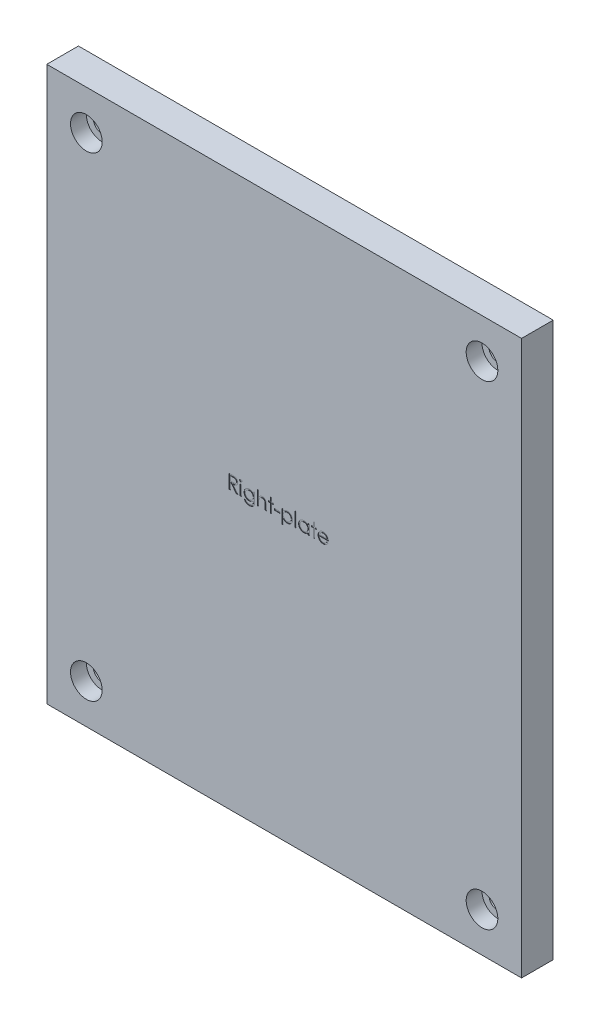
from build123d import *

# Parameters (mm, degrees)
SKETCH_1_W                   = 120
SKETCH_1_H                   = 140
EXTRUDE_1_DEPTH              = 8
HOLE_WIZARD_M4_1_D           = 4.5
HOLE_WIZARD_M4_1_CBORE_D     = 8
HOLE_WIZARD_M4_1_CBORE_DEPTH = 4
SKETCH_4_W                   = 0.314102564
SKETCH_4_H                   = 2.557692308
SKETCH_4_W_2                 = 1.346153846
SKETCH_4_H_2                 = 0.358974359
SKETCH_4_H_3                 = 3.58974359
CUT_EXTRUDE_1_DEPTH          = 0.1


with BuildPart() as part:
    # 스케치1 → 보스-돌출1 (new body)
    with BuildSketch(Plane.XY):
        Rectangle(SKETCH_1_W, SKETCH_1_H)
    extrude(amount=EXTRUDE_1_DEPTH)

    # M4 소켓 머리 캡 나사용 카운터보어1 (through all)
    with Locations(Plane.XY.offset(8)):
        with Locations((-50, 60), (50, 60), (50, -60), (-50, -60)):
            CounterBoreHole(HOLE_WIZARD_M4_1_D / 2, HOLE_WIZARD_M4_1_CBORE_D / 2, HOLE_WIZARD_M4_1_CBORE_DEPTH)

    # 스케치4 → 컷-돌출1 (cut)
    # profile 1 of 12: a face of its own
    with BuildSketch(Plane.XY.offset(8)):
        with BuildLine():
            Line((-13.94105968, 3.5), (-13.240639007, 3.5))
            add(Edge.make_bspline(
                [(-13.240639007, 3.5), (-13.193897878, 3.499844414), (-13.104149734, 3.499545672), (-12.975576464, 3.497879909), (-12.858749367, 3.493105553), (-12.753729527, 3.48899697), (-12.660518872, 3.481505028), (-12.578831581, 3.474344381), (-12.509043884, 3.46497072), (-12.466798033, 3.456265297), (-12.447670257, 3.452323718)],
                knots=[0, 0, 0, 0, 1.410062039, 2.707475311, 3.878576406, 4.937260626, 5.877586885, 6.699081471, 7.410979367, 8, 8, 8, 8], degree=3))
            add(Edge.make_bspline(
                [(-12.447670257, 3.452323718), (-12.422063633, 3.445996953), (-12.371396643, 3.433478389), (-12.298446577, 3.407018788), (-12.228932253, 3.376399163), (-12.163142429, 3.340435443), (-12.101406638, 3.298860663), (-12.043088327, 3.252392541), (-11.987922864, 3.201285335), (-11.938141233, 3.144250494), (-11.891202182, 3.084413984), (-11.851613555, 3.019710227), (-11.817487075, 2.9520487), (-11.790316558, 2.880741282), (-11.768438585, 2.80647951), (-11.753012346, 2.728590713), (-11.743761158, 2.647429738), (-11.742819302, 2.59207183), (-11.742341731, 2.564002404)],
                knots=[0, 0, 0, 0, 1.027469482, 2.033020251, 3.019912614, 3.986113645, 4.951240523, 5.91722682, 6.890402269, 7.87763091, 8.8651537, 9.85103654, 10.82876324, 11.815024772, 12.821070561, 13.842952187, 14.906261191, 16, 16, 16, 16], degree=3))
            add(Edge.make_bspline(
                [(-11.742341731, 2.564002404), (-11.743810729, 2.517367299), (-11.746677125, 2.426370131), (-11.773402229, 2.29430925), (-11.817178748, 2.171119935), (-11.877502037, 2.056957297), (-11.954321513, 1.954046652), (-12.046646304, 1.863656197), (-12.154527916, 1.788016284), (-12.254957232, 1.735563479), (-12.343671431, 1.701970571), (-12.416704744, 1.678334212), (-12.496371722, 1.660072247), (-12.581909056, 1.643712115), (-12.673672712, 1.63136042), (-12.771442751, 1.622313826), (-12.875288903, 1.616659777), (-12.946627972, 1.615817772), (-12.983327308, 1.615384615)],
                knots=[0, 0, 0, 0, 1.260483769, 2.459530307, 3.627416485, 4.787058657, 5.939039949, 7.08810263, 8.267026773, 9.491475466, 10.141966685, 10.831826277, 11.566392101, 12.351337768, 13.187381173, 14.07005841, 15.007169909, 16, 16, 16, 16], degree=3))
            Line((-12.983327308, 1.615384615), (-11.697469936, 0))
            Line((-11.697469936, 0), (-12.085891411, 0))
            Line((-12.085891411, 0), (-13.371748782, 1.615384615))
            Line((-13.371748782, 1.615384615), (-13.626957116, 1.615384615))
            Line((-13.626957116, 1.615384615), (-13.626957116, 0))
            Line((-13.626957116, 0), (-13.94105968, 0))
            Line((-13.94105968, 0), (-13.94105968, 3.5))
        make_face()
        with BuildLine():
            Line((-13.626957116, 3.141025641), (-13.626957116, 1.974358974))
            Line((-13.626957116, 1.974358974), (-12.986131795, 1.969451122))
            add(Edge.make_bspline(
                [(-12.986131795, 1.969451122), (-12.956211756, 1.969437885), (-12.898218199, 1.969412229), (-12.814317534, 1.973406005), (-12.736197423, 1.977949323), (-12.664156671, 1.984898669), (-12.598163095, 1.99385474), (-12.538249682, 2.005057725), (-12.48431863, 2.018109787), (-12.421420092, 2.038311413), (-12.35118356, 2.070317431), (-12.2748521, 2.11688293), (-12.209849763, 2.175452049), (-12.1549319, 2.242425505), (-12.110802469, 2.316061754), (-12.079690415, 2.395478123), (-12.059947972, 2.478669721), (-12.057619427, 2.535847829), (-12.056444295, 2.564703526)],
                knots=[0, 0, 0, 0, 1.146690395, 2.22261258, 3.21895312, 4.145990853, 4.996080663, 5.770904154, 6.481378293, 7.121626537, 8.300444488, 9.431385265, 10.535395872, 11.636531494, 12.74115979, 13.810798291, 14.895190096, 16, 16, 16, 16], degree=3))
            add(Edge.make_bspline(
                [(-12.056444295, 2.564703526), (-12.057646416, 2.592850099), (-12.060028582, 2.648626338), (-12.07947735, 2.730282248), (-12.112366732, 2.807349198), (-12.15668897, 2.879513683), (-12.210688124, 2.945019419), (-12.274005937, 3.001066572), (-12.344911132, 3.047316037), (-12.411182331, 3.076870418), (-12.470416543, 3.094990271), (-12.521846203, 3.107741435), (-12.579957681, 3.117985904), (-12.64503314, 3.126193964), (-12.71679477, 3.133248909), (-12.795605421, 3.138000687), (-12.880942202, 3.140814551), (-12.940089133, 3.14095364), (-12.970707116, 3.141025641)],
                knots=[0, 0, 0, 0, 1.101028733, 2.181837193, 3.264309656, 4.369019818, 5.486613113, 6.575447106, 7.666700264, 8.788928104, 9.402425223, 10.0903467, 10.862060571, 11.710948788, 12.657782767, 13.684531032, 14.801375019, 16, 16, 16, 16], degree=3))
            Line((-12.970707116, 3.141025641), (-13.626957116, 3.141025641))
        make_face(mode=Mode.SUBTRACT)
    # profile 2 of 12: a face of its own
    with BuildSketch(Plane.XY.offset(8)):
        with BuildLine():
            add(Edge.make_bspline(
                [(-10.958487564, 3.634615385), (-10.938996249, 3.633711232), (-10.900828509, 3.631940728), (-10.845635241, 3.616779251), (-10.795378229, 3.591079566), (-10.750800496, 3.556599885), (-10.71254861, 3.516050441), (-10.685767899, 3.468789473), (-10.668555503, 3.417730834), (-10.666476948, 3.382115745), (-10.665418654, 3.363982372)],
                knots=[0, 0, 0, 0, 1.055194115, 2.066272739, 3.074728998, 4.095836921, 5.109056067, 6.073838105, 7.019297344, 8, 8, 8, 8], degree=3))
            add(Edge.make_bspline(
                [(-10.665418654, 3.363982372), (-10.666500814, 3.346319719), (-10.668640116, 3.311402744), (-10.685754604, 3.261229272), (-10.712776842, 3.214624988), (-10.750775968, 3.174154278), (-10.795384729, 3.139693658), (-10.845633515, 3.113988919), (-10.900828963, 3.098828782), (-10.938996402, 3.097058093), (-10.958487564, 3.096153846)],
                knots=[0, 0, 0, 0, 0.96129708, 1.900370562, 2.859976407, 3.87933698, 4.906634145, 5.921202961, 6.938410037, 8, 8, 8, 8], degree=3))
            add(Edge.make_bspline(
                [(-10.958487564, 3.096153846), (-10.97775584, 3.097023566), (-11.01525902, 3.098716363), (-11.069625862, 3.114286381), (-11.119454352, 3.139702454), (-11.164119024, 3.173928639), (-11.201349217, 3.214873536), (-11.228447543, 3.26120083), (-11.245522505, 3.311409985), (-11.247667133, 3.346322151), (-11.248751988, 3.363982372)],
                knots=[0, 0, 0, 0, 1.054934014, 2.053291228, 3.073705704, 4.106921865, 5.123545215, 6.088680038, 7.033164197, 8, 8, 8, 8], degree=3))
            add(Edge.make_bspline(
                [(-11.248751988, 3.363982372), (-11.247690901, 3.382113221), (-11.24560686, 3.417723354), (-11.228434744, 3.468818387), (-11.201574936, 3.515799889), (-11.164094372, 3.556825388), (-11.119460912, 3.591070823), (-11.069624167, 3.616481804), (-11.015259468, 3.632053144), (-10.977755992, 3.633745758), (-10.958487564, 3.634615385)],
                knots=[0, 0, 0, 0, 0.98631895, 1.937192651, 2.907499808, 3.917963147, 4.944918757, 5.95915025, 6.951458133, 8, 8, 8, 8], degree=3))
        make_face()
    # profile 3 of 12: a face of its own
    with BuildSketch(Plane.XY.offset(8)):
        with Locations((-10.957085321, 1.278846154)):
            Rectangle(SKETCH_4_W, SKETCH_4_H)
    # profile 4 of 12: a face of its own
    with BuildSketch(Plane.XY.offset(8)):
        with BuildLine():
            Line((-7.793623782, 2.557692308), (-7.479521218, 2.557692308))
            Line((-7.479521218, 2.557692308), (-7.479521218, 0.527944712))
            add(Edge.make_bspline(
                [(-7.479521218, 0.527944712), (-7.479798261, 0.484707117), (-7.48033302, 0.401248144), (-7.484183991, 0.280569865), (-7.492304668, 0.169103779), (-7.50151335, 0.06634152), (-7.514760066, -0.02724059), (-7.530936433, -0.111921794), (-7.549172112, -0.187783357), (-7.56519233, -0.234508198), (-7.572770417, -0.256610577)],
                knots=[0, 0, 0, 0, 1.307562039, 2.523909702, 3.650326591, 4.686913197, 5.643429486, 6.506965704, 7.293745905, 8, 8, 8, 8], degree=3))
            add(Edge.make_bspline(
                [(-7.572770417, -0.256610577), (-7.583959656, -0.285340499), (-7.606003582, -0.341941336), (-7.647289216, -0.422175656), (-7.693523119, -0.497722046), (-7.74632987, -0.568159497), (-7.805470674, -0.63313441), (-7.869552166, -0.694058409), (-7.939822358, -0.749642577), (-8.01624107, -0.798927874), (-8.097046703, -0.843314928), (-8.182192805, -0.881761495), (-8.271199243, -0.915248339), (-8.364902135, -0.940331135), (-8.461832369, -0.962065855), (-8.563129801, -0.976210541), (-8.668202597, -0.985837599), (-8.739647977, -0.986727832), (-8.775895417, -0.987179487)],
                knots=[0, 0, 0, 0, 0.981931301, 1.934503488, 2.87077864, 3.801706999, 4.735015492, 5.667491629, 6.616593066, 7.585388521, 8.561939025, 9.551802639, 10.560317337, 11.588439944, 12.640189604, 13.723962949, 14.845264515, 16, 16, 16, 16], degree=3))
            add(Edge.make_bspline(
                [(-8.775895417, -0.987179487), (-8.828780152, -0.986323001), (-8.932078247, -0.984650054), (-9.08268324, -0.965159139), (-9.225717959, -0.937604766), (-9.359292416, -0.895899339), (-9.482562513, -0.844862349), (-9.594686389, -0.786267396), (-9.694657496, -0.719078087), (-9.784781169, -0.642577486), (-9.866122759, -0.551613805), (-9.942650049, -0.444414961), (-10.016310991, -0.319348071), (-10.059479629, -0.227555358), (-10.082085321, -0.179487179)],
                knots=[0, 0, 0, 0, 1.157897085, 2.2616841, 3.32207898, 4.345638746, 5.321241055, 6.241986252, 7.112515963, 7.955008012, 8.825025602, 9.77857164, 10.836726669, 12, 12, 12, 12], degree=3))
            Line((-10.082085321, -0.179487179), (-9.767982757, -0.179487179))
            add(Edge.make_bspline(
                [(-9.767982757, -0.179487179), (-9.742720547, -0.219593055), (-9.693336039, -0.297995104), (-9.600987558, -0.39950826), (-9.499781232, -0.486261624), (-9.386301549, -0.556172398), (-9.260076333, -0.60888219), (-9.121029647, -0.646457486), (-8.968030025, -0.668953753), (-8.861511811, -0.671665047), (-8.806043654, -0.673076923)],
                knots=[0, 0, 0, 0, 0.997731894, 1.950442991, 2.880492273, 3.800895997, 4.748200782, 5.754801363, 6.83083817, 8, 8, 8, 8], degree=3))
            add(Edge.make_bspline(
                [(-8.806043654, -0.673076923), (-8.751276764, -0.671646774), (-8.645691681, -0.668889591), (-8.493860512, -0.646447446), (-8.355265574, -0.608874013), (-8.230705373, -0.556265626), (-8.121649605, -0.49181522), (-8.027637614, -0.419815145), (-7.951492938, -0.338634142), (-7.900279971, -0.263852336), (-7.868445353, -0.197228207), (-7.848173116, -0.139875611), (-7.831699147, -0.075022733), (-7.81791931, -0.002886997), (-7.806548396, 0.07663466), (-7.799345514, 0.163724064), (-7.794139702, 0.258183286), (-7.793799732, 0.323676424), (-7.793623782, 0.357572115)],
                knots=[0, 0, 0, 0, 1.570740765, 3.028230971, 4.391408896, 5.680370741, 6.894727393, 8.017376726, 9.065722033, 10.075533815, 10.603371122, 11.180248986, 11.817768598, 12.521299649, 13.286540596, 14.121245857, 15.027658897, 16, 16, 16, 16], degree=3))
            Line((-7.793623782, 0.357572115), (-7.793623782, 0.490084135))
            add(Edge.make_bspline(
                [(-7.793623782, 0.490084135), (-7.8255049, 0.452142332), (-7.888706356, 0.376926113), (-7.997853683, 0.278364476), (-8.117070598, 0.193478346), (-8.246154141, 0.123859711), (-8.381942383, 0.068178287), (-8.522964613, 0.029235326), (-8.667956669, 0.004075426), (-8.766208818, 0.00136811), (-8.815859359, 0)],
                knots=[0, 0, 0, 0, 1.012485704, 2.007162095, 2.997754123, 3.998611389, 4.999708251, 5.992315798, 6.98544096, 8, 8, 8, 8], degree=3))
            add(Edge.make_bspline(
                [(-8.815859359, 0), (-8.845095629, 0.000515026), (-8.903222186, 0.001538985), (-8.989576934, 0.010497762), (-9.074657372, 0.023496504), (-9.158265076, 0.042577943), (-9.240520689, 0.06706967), (-9.321288281, 0.097686409), (-9.401221807, 0.132301527), (-9.478868305, 0.17307433), (-9.553454436, 0.218436637), (-9.624417621, 0.267575528), (-9.69138616, 0.320233816), (-9.75372265, 0.376930756), (-9.811345321, 0.437584289), (-9.865029189, 0.501547842), (-9.913886536, 0.569714583), (-9.958919925, 0.640841541), (-9.997977476, 0.715402464), (-10.032261848, 0.79178056), (-10.062071253, 0.869812514), (-10.085836654, 0.949759577), (-10.103987768, 1.031571346), (-10.117497995, 1.115113795), (-10.125160926, 1.200644182), (-10.12635585, 1.258265532), (-10.126957116, 1.287259615)],
                knots=[0, 0, 0, 0, 1.028754217, 2.045334182, 3.052854819, 4.056607503, 5.061168794, 6.071104265, 7.095078842, 8.125279047, 9.155117945, 10.165957491, 11.161587969, 12.151493252, 13.128948131, 14.104219989, 15.088194871, 16.07871515, 17.064853787, 18.047899887, 19.02414258, 20.002704429, 20.980574569, 21.971845993, 22.979467364, 24, 24, 24, 24], degree=3))
            add(Edge.make_bspline(
                [(-10.126957116, 1.287259615), (-10.126437949, 1.316262711), (-10.125401628, 1.37415657), (-10.116450648, 1.460035956), (-10.103682459, 1.544765391), (-10.08347469, 1.627471533), (-10.059152167, 1.709096284), (-10.029028595, 1.789036741), (-9.992809836, 1.86731725), (-9.951800086, 1.943995781), (-9.905715993, 2.018043396), (-9.855183512, 2.088370042), (-9.800141638, 2.154458214), (-9.741349723, 2.216974636), (-9.678089906, 2.275316129), (-9.610394913, 2.329341094), (-9.538932033, 2.37995512), (-9.463479783, 2.426066457), (-9.385202394, 2.466848704), (-9.306088577, 2.504061301), (-9.225090342, 2.53359542), (-9.143717802, 2.559618519), (-9.060537887, 2.578053715), (-8.976570494, 2.592275957), (-8.891528156, 2.600940678), (-8.834575261, 2.602022263), (-8.806043654, 2.602564103)],
                knots=[0, 0, 0, 0, 1.008818848, 2.013730394, 3.001654427, 3.987803273, 4.973046549, 5.963777569, 6.957074694, 7.972068341, 8.987420212, 9.989399531, 10.982630087, 11.977756091, 12.973280677, 13.973972381, 14.989194003, 16.018387222, 17.047741039, 18.059210846, 19.057554164, 20.045176975, 21.029480261, 22.018708529, 23.007435371, 24, 24, 24, 24], degree=3))
            add(Edge.make_bspline(
                [(-8.806043654, 2.602564103), (-8.758992715, 2.601207429), (-8.666081568, 2.598528416), (-8.529350565, 2.577507271), (-8.397408326, 2.543993258), (-8.26951031, 2.495977627), (-8.144614659, 2.430427589), (-8.023133004, 2.344084641), (-7.904713869, 2.236174301), (-7.831636039, 2.153421437), (-7.793623782, 2.110376603)],
                knots=[0, 0, 0, 0, 0.96728863, 1.910097829, 2.838038873, 3.762875196, 4.71315279, 5.730631239, 6.819562287, 8, 8, 8, 8], degree=3))
            Line((-7.793623782, 2.110376603), (-7.793623782, 2.557692308))
        make_face()
        with BuildLine():
            add(Edge.make_bspline(
                [(-8.78080327, 2.288461538), (-8.826733973, 2.286900473), (-8.917667028, 2.283809894), (-9.05095537, 2.257425181), (-9.179632304, 2.216079281), (-9.301237732, 2.156936666), (-9.415144842, 2.084842428), (-9.516219662, 1.99750214), (-9.604624578, 1.897755943), (-9.679407517, 1.786505696), (-9.738938883, 1.666483421), (-9.781082303, 1.539972687), (-9.808332326, 1.409017694), (-9.811339978, 1.319645091), (-9.812854552, 1.274639423)],
                knots=[0, 0, 0, 0, 1.026226791, 2.031711442, 3.026614839, 4.04107745, 5.047145931, 6.032893242, 7.017642609, 8.019221815, 9.021877557, 10.003543541, 10.994637589, 12, 12, 12, 12], degree=3))
            add(Edge.make_bspline(
                [(-9.812854552, 1.274639423), (-9.812128795, 1.240706151), (-9.810701443, 1.173969327), (-9.796977866, 1.076031432), (-9.7747969, 0.982751118), (-9.743359694, 0.894122744), (-9.704406999, 0.809637949), (-9.655414628, 0.729878714), (-9.597763657, 0.654774008), (-9.531905319, 0.584879326), (-9.459328937, 0.521218358), (-9.380609738, 0.465280317), (-9.295854488, 0.419529596), (-9.207147678, 0.379988759), (-9.112336922, 0.351109691), (-9.012787836, 0.329070912), (-8.907796139, 0.316462154), (-8.8362244, 0.314899356), (-8.799733558, 0.314102564)],
                knots=[0, 0, 0, 0, 1.039728707, 2.044842319, 3.024901384, 3.974314358, 4.923051295, 5.871625912, 6.837440708, 7.820715446, 8.810779094, 9.792721783, 10.773906224, 11.758876063, 12.764959493, 13.806266761, 14.881525401, 16, 16, 16, 16], degree=3))
            add(Edge.make_bspline(
                [(-8.799733558, 0.314102564), (-8.7627698, 0.314870173), (-8.690487562, 0.316371224), (-8.584916626, 0.329274723), (-8.484883886, 0.350096699), (-8.390481063, 0.379659725), (-8.301351722, 0.417381475), (-8.218497108, 0.465118093), (-8.14014066, 0.519482525), (-8.06878425, 0.582894539), (-8.004260084, 0.652779534), (-7.948029318, 0.728824429), (-7.900114869, 0.809884948), (-7.860437199, 0.895951954), (-7.830145995, 0.987694307), (-7.80982709, 1.084882663), (-7.795620344, 1.187051401), (-7.79429942, 1.257060018), (-7.793623782, 1.29286859)],
                knots=[0, 0, 0, 0, 1.121943988, 2.193949579, 3.223793937, 4.220241907, 5.192961521, 6.155822191, 7.11847367, 8.083710714, 9.04790392, 10.001595906, 10.949595423, 11.902125208, 12.873731292, 13.87582262, 14.913508608, 16, 16, 16, 16], degree=3))
            add(Edge.make_bspline(
                [(-7.793623782, 1.29286859), (-7.794963351, 1.339486444), (-7.797580396, 1.430561349), (-7.822277554, 1.563268117), (-7.862097764, 1.68803679), (-7.917944516, 1.804472766), (-7.987926525, 1.911342316), (-8.072217374, 2.006666161), (-8.169363404, 2.090567017), (-8.279085505, 2.160465211), (-8.39713295, 2.216930645), (-8.520654146, 2.259292417), (-8.64946571, 2.283286732), (-8.736772119, 2.286726675), (-8.78080327, 2.288461538)],
                knots=[0, 0, 0, 0, 1.070913519, 2.092188694, 3.091357305, 4.074328408, 5.051968682, 6.018948707, 6.99050112, 7.9935919, 9.000589572, 9.992915277, 10.987769056, 12, 12, 12, 12], degree=3))
        make_face(mode=Mode.SUBTRACT)
    # profile 5 of 12: a face of its own
    with BuildSketch(Plane.XY.offset(8)):
        with BuildLine():
            Line((-6.7615725, 3.58974359), (-6.447469936, 3.58974359))
            Line((-6.447469936, 3.58974359), (-6.447469936, 2.074619391))
            add(Edge.make_bspline(
                [(-6.447469936, 2.074619391), (-6.413752635, 2.116763373), (-6.348103321, 2.198819866), (-6.237607204, 2.305881057), (-6.124136332, 2.398679678), (-6.003771522, 2.472550135), (-5.878721002, 2.530906678), (-5.748457357, 2.572294325), (-5.612956386, 2.597745421), (-5.520931236, 2.600943839), (-5.474312885, 2.602564103)],
                knots=[0, 0, 0, 0, 1.125788106, 2.19196713, 3.20547328, 4.180437432, 5.132270164, 6.079753143, 7.027236121, 8, 8, 8, 8], degree=3))
            add(Edge.make_bspline(
                [(-5.474312885, 2.602564103), (-5.426982492, 2.600818672), (-5.334345497, 2.597402444), (-5.199464034, 2.570389063), (-5.073503159, 2.524231625), (-4.956837316, 2.4610646), (-4.852012619, 2.382391773), (-4.759162855, 2.29156025), (-4.683322056, 2.186286332), (-4.631722939, 2.089030078), (-4.598149531, 2.002491324), (-4.576897705, 1.928254812), (-4.558878507, 1.845532899), (-4.543178771, 1.754368166), (-4.532715189, 1.654322995), (-4.524310571, 1.545848741), (-4.518334117, 1.428951622), (-4.518102513, 1.348031373), (-4.517982757, 1.306189904)],
                knots=[0, 0, 0, 0, 1.235656852, 2.418478516, 3.575258207, 4.727955599, 5.870717718, 6.98870536, 8.107142894, 9.245821548, 9.854588956, 10.528768408, 11.260415777, 12.065282286, 12.943670737, 13.886611085, 14.907229059, 16, 16, 16, 16], degree=3))
            Line((-4.517982757, 1.306189904), (-4.517982757, 0))
            Line((-4.517982757, 0), (-4.832085321, 0))
            Line((-4.832085321, 0), (-4.832085321, 1.203125))
            add(Edge.make_bspline(
                [(-4.832085321, 1.203125), (-4.832275624, 1.23794767), (-4.832639642, 1.30455751), (-4.833842986, 1.399923618), (-4.836529202, 1.486419753), (-4.840870027, 1.563768705), (-4.845435335, 1.632078308), (-4.851718652, 1.691249362), (-4.859028886, 1.741363138), (-4.865597667, 1.771527766), (-4.868543654, 1.78505609)],
                knots=[0, 0, 0, 0, 1.430932559, 2.737130458, 3.918967929, 4.986496826, 5.920444988, 6.731744033, 7.431208747, 8, 8, 8, 8], degree=3))
            add(Edge.make_bspline(
                [(-4.868543654, 1.78505609), (-4.879967899, 1.824750353), (-4.901930944, 1.901062344), (-4.952978921, 2.004724754), (-5.016737932, 2.093109495), (-5.094585194, 2.165023783), (-5.185143558, 2.221435322), (-5.289003522, 2.260503105), (-5.40518759, 2.284750827), (-5.487039062, 2.28719013), (-5.529701507, 2.288461538)],
                knots=[0, 0, 0, 0, 1.090059168, 2.095632401, 3.037101401, 3.955032261, 4.878929692, 5.839099886, 6.873700383, 8, 8, 8, 8], degree=3))
            add(Edge.make_bspline(
                [(-5.529701507, 2.288461538), (-5.55496928, 2.287985712), (-5.60497355, 2.287044064), (-5.679122216, 2.277590166), (-5.75105128, 2.262141447), (-5.821453457, 2.241236908), (-5.888836655, 2.212791372), (-5.95516498, 2.179861183), (-6.018559189, 2.139552928), (-6.080145006, 2.09432716), (-6.137462539, 2.0442574), (-6.190789655, 1.991410445), (-6.238327995, 1.935135481), (-6.281396586, 1.876335365), (-6.318574872, 1.814203572), (-6.351027954, 1.749339253), (-6.37856365, 1.681657108), (-6.392246342, 1.634682046), (-6.399092532, 1.611177885)],
                knots=[0, 0, 0, 0, 1.024319606, 2.027102035, 3.025350316, 4.005802111, 5.00026367, 5.987881639, 7.005602596, 8.042517216, 9.083927026, 10.089214625, 11.084353441, 12.06828073, 13.041928858, 14.016821737, 15.00770877, 16, 16, 16, 16], degree=3))
            add(Edge.make_bspline(
                [(-6.399092532, 1.611177885), (-6.40303196, 1.594156934), (-6.411616456, 1.557066187), (-6.42093129, 1.495891863), (-6.429269086, 1.424805491), (-6.436317636, 1.34391489), (-6.440640723, 1.252923648), (-6.445298963, 1.152452689), (-6.447032977, 1.041872668), (-6.44731993, 0.964977161), (-6.447469936, 0.924779647)],
                knots=[0, 0, 0, 0, 0.607992626, 1.324890765, 2.152360218, 3.099583803, 4.150613268, 5.323148443, 6.60066238, 8, 8, 8, 8], degree=3))
            Line((-6.447469936, 0.924779647), (-6.447469936, 0))
            Line((-6.447469936, 0), (-6.7615725, 0))
            Line((-6.7615725, 0), (-6.7615725, 3.58974359))
        make_face()
    # profile 6 of 12: a face of its own
    with BuildSketch(Plane.XY.offset(8)):
        Polygon((-3.485931475, 3.58974359), (-3.171828911, 3.58974359), (-3.171828911, 2.557692308), (-2.723110962, 2.557692308), (-2.723110962, 2.243589744), (-3.171828911, 2.243589744), (-3.171828911, 0), (-3.485931475, 0), (-3.485931475, 2.243589744), (-3.934649423, 2.243589744), (-3.934649423, 2.557692308), (-3.485931475, 2.557692308), align=None)
    # profile 7 of 12: a face of its own
    with BuildSketch(Plane.XY.offset(8)):
        with Locations((-1.735931475, 1.346153847)):
            Rectangle(SKETCH_4_W_2, SKETCH_4_H_2)
    # profile 8 of 12: a face of its own
    with BuildSketch(Plane.XY.offset(8)):
        with BuildLine():
            Line((-0.569264808, 2.557692308), (-0.255162244, 2.557692308))
            Line((-0.255162244, 2.557692308), (-0.255162244, 2.084435096))
            add(Edge.make_bspline(
                [(-0.255162244, 2.084435096), (-0.22180476, 2.12737283), (-0.156981165, 2.210813723), (-0.04525626, 2.318803851), (0.072670549, 2.409879155), (0.199833961, 2.481261688), (0.334257651, 2.5350825), (0.475389969, 2.57486195), (0.624428733, 2.598303424), (0.726325186, 2.601125086), (0.778291282, 2.602564103)],
                knots=[0, 0, 0, 0, 1.0828784, 2.104357462, 3.088488658, 4.04616522, 5.001424249, 5.969181776, 6.964304535, 8, 8, 8, 8], degree=3))
            add(Edge.make_bspline(
                [(0.778291282, 2.602564103), (0.823682885, 2.601250924), (0.913401773, 2.598655357), (1.045465002, 2.581082302), (1.172640386, 2.55096461), (1.29420844, 2.507563694), (1.411471505, 2.453908224), (1.522693605, 2.386191189), (1.62960716, 2.307784998), (1.729523349, 2.217552847), (1.821844717, 2.119924581), (1.901690898, 2.014902277), (1.970562802, 1.90593969), (2.026233099, 1.791347598), (2.069841446, 1.672028368), (2.100856124, 1.547499927), (2.119313767, 1.418223987), (2.121790219, 1.330321266), (2.123042884, 1.285857372)],
                knots=[0, 0, 0, 0, 1.041296284, 2.058176809, 3.050446431, 4.034000596, 5.01514041, 6.003636468, 7.015969324, 8.052561599, 9.08815499, 10.094063707, 11.074456064, 12.040834395, 13.011057502, 13.983766392, 14.980127149, 16, 16, 16, 16], degree=3))
            add(Edge.make_bspline(
                [(2.123042884, 1.285857372), (2.121817399, 1.240455063), (2.119400564, 1.150915159), (2.100655558, 1.019428062), (2.070698684, 0.892940688), (2.027640501, 0.771663424), (1.971999013, 0.655679773), (1.904294452, 0.545073377), (1.824407985, 0.439879674), (1.733106858, 0.341526774), (1.634053922, 0.250927461), (1.528176432, 0.171689391), (1.417117506, 0.105148016), (1.301445339, 0.049565056), (1.180169701, 0.007672872), (1.053856423, -0.022544929), (0.922574277, -0.041179424), (0.833273125, -0.043631567), (0.788106987, -0.044871795)],
                knots=[0, 0, 0, 0, 1.038740735, 2.04854663, 3.033179607, 4.009277356, 4.987731542, 5.972001279, 6.972200261, 8.005528982, 9.039189865, 10.040446548, 11.026516639, 11.997840187, 12.972163198, 13.956796175, 14.96660207, 16, 16, 16, 16], degree=3))
            add(Edge.make_bspline(
                [(0.788106987, -0.044871795), (0.737279415, -0.043576987), (0.636880059, -0.041019362), (0.490082388, -0.015099952), (0.348805536, 0.023636983), (0.214614712, 0.080335977), (0.086446899, 0.152591493), (-0.034972907, 0.240701699), (-0.150289659, 0.344482324), (-0.219698417, 0.42321414), (-0.255162244, 0.463441506)],
                knots=[0, 0, 0, 0, 1.014726462, 2.004382257, 2.969841629, 3.936926163, 4.907207904, 5.903978561, 6.929055279, 8, 8, 8, 8], degree=3))
            Line((-0.255162244, 0.463441506), (-0.255162244, -0.942307692))
            Line((-0.255162244, -0.942307692), (-0.569264808, -0.942307692))
            Line((-0.569264808, -0.942307692), (-0.569264808, 2.557692308))
        make_face()
        with BuildLine():
            add(Edge.make_bspline(
                [(0.775486794, 2.288461538), (0.739907232, 2.28782128), (0.669860244, 2.286560777), (0.567188025, 2.271586828), (0.468292598, 2.249849087), (0.374170646, 2.216937187), (0.28392003, 2.176538373), (0.198235865, 2.126056362), (0.117178297, 2.066404356), (0.040951267, 1.998725013), (-0.027912027, 1.924150324), (-0.088874955, 1.844562515), (-0.14008226, 1.760062376), (-0.18258428, 1.671437013), (-0.214927563, 1.577991728), (-0.237883282, 1.480258715), (-0.252313635, 1.378131003), (-0.254202572, 1.308574996), (-0.255162244, 1.273237179)],
                knots=[0, 0, 0, 0, 1.05670511, 2.080379991, 3.077984906, 4.06214886, 5.038337365, 6.01289324, 7.01187578, 8.025460281, 9.038092164, 10.024533457, 11.000252242, 11.969694649, 12.940728589, 13.933144304, 14.949937299, 16, 16, 16, 16], degree=3))
            add(Edge.make_bspline(
                [(-0.255162244, 1.273237179), (-0.253571388, 1.226849067), (-0.250454766, 1.135970826), (-0.225117398, 1.003186704), (-0.183882134, 0.877535048), (-0.12535342, 0.760074011), (-0.051405846, 0.652091176), (0.03769231, 0.55540057), (0.141134861, 0.470609979), (0.257202053, 0.399188725), (0.381624184, 0.341200659), (0.511410096, 0.299686448), (0.644774977, 0.27411422), (0.734943296, 0.270867401), (0.780394647, 0.269230769)],
                knots=[0, 0, 0, 0, 1.03728447, 2.032128127, 3.01272805, 3.987917167, 4.958271349, 5.931593992, 6.91984656, 7.941419022, 8.973179163, 9.983609215, 10.983593296, 12, 12, 12, 12], degree=3))
            add(Edge.make_bspline(
                [(0.780394647, 0.269230769), (0.824930415, 0.270787146), (0.913325908, 0.273876274), (1.043484029, 0.300614462), (1.169974668, 0.341459487), (1.29015484, 0.401019043), (1.402978328, 0.474009101), (1.504859882, 0.561569134), (1.593866795, 0.663059077), (1.66973115, 0.77606758), (1.730862636, 0.897242964), (1.776792876, 1.022624353), (1.803301449, 1.151769776), (1.807058237, 1.238767489), (1.80894032, 1.282351763)],
                knots=[0, 0, 0, 0, 1.00104056, 1.986885549, 2.97790532, 3.984399681, 4.995088187, 5.994304198, 6.996462723, 8.023150851, 9.048424203, 10.043036403, 11.019596776, 12, 12, 12, 12], degree=3))
            add(Edge.make_bspline(
                [(1.80894032, 1.282351763), (1.807485586, 1.326206752), (1.804587452, 1.413575056), (1.776040415, 1.542337959), (1.733140437, 1.668225935), (1.670581385, 1.787746484), (1.596380116, 1.900520567), (1.506633119, 2.000074446), (1.406016922, 2.087245119), (1.293327758, 2.159260529), (1.172387333, 2.216546024), (1.045072417, 2.258429663), (0.912028815, 2.283603412), (0.82140116, 2.286827918), (0.775486794, 2.288461538)],
                knots=[0, 0, 0, 0, 0.983928682, 1.960191568, 2.949917689, 3.96440592, 4.982380491, 5.975291189, 6.965713506, 7.964880129, 8.970154049, 9.96478489, 10.968906225, 12, 12, 12, 12], degree=3))
        make_face(mode=Mode.SUBTRACT)
    # profile 9 of 12: a face of its own
    with BuildSketch(Plane.XY.offset(8)):
        with Locations((2.8634275, 1.794871795)):
            Rectangle(SKETCH_4_W, SKETCH_4_H_3)
    # profile 10 of 12: a face of its own
    with BuildSketch(Plane.XY.offset(8)):
        with BuildLine():
            Line((6.340991602, 2.557692308), (6.340991602, 0))
            Line((6.340991602, 0), (6.026889038, 0))
            Line((6.026889038, 0), (6.026889038, 0.442407853))
            add(Edge.make_bspline(
                [(6.026889038, 0.442407853), (5.991470247, 0.402368259), (5.922350032, 0.324230488), (5.806908914, 0.222148315), (5.684540736, 0.137769993), (5.555839415, 0.069620078), (5.420921172, 0.018428021), (5.280085085, -0.017958138), (5.133273704, -0.041351973), (5.033021349, -0.043687995), (4.982217564, -0.044871795)],
                knots=[0, 0, 0, 0, 1.074387032, 2.096679803, 3.090159297, 4.057316773, 5.018401886, 5.985159533, 6.978961417, 8, 8, 8, 8], degree=3))
            add(Edge.make_bspline(
                [(4.982217564, -0.044871795), (4.93704961, -0.043645423), (4.847976405, -0.041226962), (4.716947328, -0.022464659), (4.590855078, 0.007665963), (4.469580506, 0.049566853), (4.35390836, 0.105147674), (4.242848264, 0.171688922), (4.136975572, 0.250929752), (4.037904033, 0.341517781), (3.946672032, 0.439912768), (3.86661076, 0.544858315), (3.79985768, 0.655900619), (3.744037599, 0.771633773), (3.701041255, 0.892948692), (3.67106762, 1.01942586), (3.652327174, 1.150915734), (3.649909713, 1.240455257), (3.64868391, 1.285857372)],
                knots=[0, 0, 0, 0, 1.033919861, 2.038935746, 3.024066025, 3.998881131, 4.97069526, 5.957263378, 6.95902576, 7.993208707, 9.027059324, 10.027763471, 11.009749337, 11.988697705, 12.965288445, 13.950418724, 14.960734635, 16, 16, 16, 16], degree=3))
            add(Edge.make_bspline(
                [(3.64868391, 1.285857372), (3.649936881, 1.330321075), (3.652413938, 1.418223419), (3.670867158, 1.547502117), (3.701898167, 1.672020377), (3.745446014, 1.791377321), (3.801287969, 1.905717371), (3.869216056, 2.015121396), (3.949235181, 2.119890793), (4.041487588, 2.21756202), (4.141422358, 2.307782634), (4.248331089, 2.38619168), (4.35955437, 2.453908529), (4.476817381, 2.507562005), (4.598384486, 2.550971109), (4.725337931, 2.581004078), (4.85714951, 2.598701399), (4.946640002, 2.601264163), (4.992033269, 2.602564103)],
                knots=[0, 0, 0, 0, 1.020392517, 2.01726096, 2.990465484, 3.961182959, 4.928053699, 5.906110375, 6.912531644, 7.948652711, 8.985773172, 9.998621852, 10.987621588, 11.969261332, 12.953316658, 13.946091881, 14.958173133, 16, 16, 16, 16], degree=3))
            add(Edge.make_bspline(
                [(4.992033269, 2.602564103), (5.044233128, 2.601126351), (5.146594588, 2.598306988), (5.296322597, 2.574844261), (5.437967075, 2.535205794), (5.572621427, 2.481288296), (5.699802113, 2.409639567), (5.818305098, 2.319259606), (5.929370581, 2.210718419), (5.993750872, 2.127347974), (6.026889038, 2.084435096)],
                knots=[0, 0, 0, 0, 1.038897134, 2.037228247, 3.008116434, 3.962042015, 4.918381754, 5.904844433, 6.921570401, 8, 8, 8, 8], degree=3))
            Line((6.026889038, 2.084435096), (6.026889038, 2.557692308))
            Line((6.026889038, 2.557692308), (6.340991602, 2.557692308))
        make_face()
        with BuildLine():
            add(Edge.make_bspline(
                [(4.99624, 2.288461538), (4.950325662, 2.286827901), (4.859698062, 2.28360336), (4.72665406, 2.258429865), (4.599340646, 2.21654527), (4.478394571, 2.159263369), (4.365726355, 2.087234632), (4.265032684, 2.000113249), (4.175489983, 1.900276235), (4.100181718, 1.788174125), (4.038791221, 1.667996033), (3.995624189, 1.542371595), (3.967154942, 1.413566618), (3.964246421, 1.326203932), (3.962786474, 1.282351763)],
                knots=[0, 0, 0, 0, 1.031046209, 2.035121221, 3.029706178, 4.034933723, 5.034054252, 6.02443088, 7.017295772, 8.038157696, 9.050218397, 10.03989886, 11.016116709, 12, 12, 12, 12], degree=3))
            add(Edge.make_bspline(
                [(3.962786474, 1.282351763), (3.964651367, 1.238761656), (3.968373844, 1.1517523), (3.995124539, 1.022771723), (4.040004412, 0.897117681), (4.101246475, 0.775856687), (4.177933099, 0.663272587), (4.266821752, 0.561532464), (4.368772033, 0.474042876), (4.48169954, 0.400805303), (4.602307511, 0.341642782), (4.729141442, 0.300477142), (4.85981708, 0.273899362), (4.948669414, 0.270794885), (4.993435512, 0.269230769)],
                knots=[0, 0, 0, 0, 0.979072187, 1.954306742, 2.945804271, 3.96968567, 4.997920485, 5.998718438, 6.996577872, 8.005894225, 9.015743152, 10.005417472, 10.995077863, 12, 12, 12, 12], degree=3))
            add(Edge.make_bspline(
                [(4.993435512, 0.269230769), (5.038882015, 0.270890733), (5.129270602, 0.274192237), (5.26270931, 0.299473502), (5.392204272, 0.3412423), (5.515991501, 0.399141427), (5.631307632, 0.470898783), (5.73480551, 0.554905874), (5.822321478, 0.652609058), (5.896514087, 0.759985511), (5.954689504, 0.877697508), (5.997065563, 1.003031698), (6.022119469, 1.135992447), (6.025277199, 1.226856374), (6.026889038, 1.273237179)],
                knots=[0, 0, 0, 0, 1.01762866, 2.023962475, 3.030623092, 4.058876274, 5.077231937, 6.066672613, 7.034107872, 8.005628644, 8.981990164, 9.965428785, 10.961468474, 12, 12, 12, 12], degree=3))
            add(Edge.make_bspline(
                [(6.026889038, 1.273237179), (6.025929382, 1.30857501), (6.024040474, 1.378131043), (6.009609905, 1.480258561), (5.986654978, 1.577992287), (5.954308808, 1.671434976), (5.911817524, 1.760069991), (5.860569758, 1.844533752), (5.799664308, 1.924386963), (5.730081612, 1.998530034), (5.65391641, 2.066156496), (5.573321869, 2.126520737), (5.487343122, 2.17610951), (5.397426085, 2.217150781), (5.303414751, 2.249809931), (5.204544131, 2.271597625), (5.101865144, 2.286557946), (5.031819089, 2.287820327), (4.99624, 2.288461538)],
                knots=[0, 0, 0, 0, 1.050140795, 2.067009409, 3.05949893, 4.030605086, 5.00011959, 5.97591094, 6.962425594, 7.979863591, 8.993523472, 9.986985069, 10.967611495, 11.937549037, 12.921786183, 13.919465291, 14.943216303, 16, 16, 16, 16], degree=3))
        make_face(mode=Mode.SUBTRACT)
    # profile 11 of 12: a face of its own
    with BuildSketch(Plane.XY.offset(8)):
        Polygon((7.373042884, 3.58974359), (7.687145448, 3.58974359), (7.687145448, 2.557692308), (8.135863397, 2.557692308), (8.135863397, 2.243589744), (7.687145448, 2.243589744), (7.687145448, 0), (7.373042884, 0), (7.373042884, 2.243589744), (6.924324936, 2.243589744), (6.924324936, 2.557692308), (7.373042884, 2.557692308), align=None)
    # profile 12 of 12: a face of its own
    with BuildSketch(Plane.XY.offset(8)):
        with BuildLine():
            Line((10.773483589, 0.807692308), (11.052530064, 0.661157853))
            add(Edge.make_bspline(
                [(11.052530064, 0.661157853), (11.030293468, 0.621714521), (10.98702986, 0.544973418), (10.912629112, 0.439541558), (10.83463704, 0.344693842), (10.749533072, 0.262964188), (10.659863393, 0.191712803), (10.565130738, 0.129374978), (10.46484192, 0.076256458), (10.358992195, 0.03150393), (10.246692644, -0.002905564), (10.127671128, -0.027209785), (10.001699632, -0.042233054), (9.915353452, -0.043978194), (9.871139839, -0.044871795)],
                knots=[0, 0, 0, 0, 1.120438281, 2.179929193, 3.190490725, 4.156257408, 5.095198341, 6.022838206, 6.959905092, 7.901321166, 8.864066838, 9.862729781, 10.905609505, 12, 12, 12, 12], degree=3))
            add(Edge.make_bspline(
                [(9.871139839, -0.044871795), (9.821997862, -0.04372462), (9.7261361, -0.041486813), (9.586596353, -0.022194348), (9.455216935, 0.00927801), (9.332005231, 0.053243552), (9.217262979, 0.110670876), (9.110762124, 0.180630358), (9.011942598, 0.262762612), (8.923918389, 0.357779056), (8.844674506, 0.459461013), (8.774748686, 0.565416898), (8.716291255, 0.675380122), (8.668738645, 0.788650646), (8.63033378, 0.90451454), (8.603567076, 1.024026007), (8.588137328, 1.146861592), (8.585772883, 1.229958927), (8.584581346, 1.271834936)],
                knots=[0, 0, 0, 0, 1.145258523, 2.234067595, 3.276747158, 4.290159414, 5.277019952, 6.260822364, 7.254936242, 8.264827045, 9.274100331, 10.257902744, 11.220704747, 12.172965371, 13.118907548, 14.062713208, 15.023725156, 16, 16, 16, 16], degree=3))
            add(Edge.make_bspline(
                [(8.584581346, 1.271834936), (8.585640487, 1.311129766), (8.587739565, 1.389006931), (8.600970353, 1.504272476), (8.624418646, 1.616300928), (8.65659497, 1.725185376), (8.698146216, 1.83074351), (8.748978435, 1.933039574), (8.809170813, 2.031964713), (8.855643487, 2.094367847), (8.8790525, 2.125801282)],
                knots=[0, 0, 0, 0, 1.024358464, 2.0301432, 3.019427413, 4.004406732, 4.986367066, 5.972626655, 6.978780325, 8, 8, 8, 8], degree=3))
            add(Edge.make_bspline(
                [(8.8790525, 2.125801282), (8.910760182, 2.163670152), (8.973171129, 2.238208303), (9.078727484, 2.336146628), (9.193027681, 2.418190404), (9.314639307, 2.48619754), (9.444975781, 2.537871187), (9.582285072, 2.576378769), (9.728130658, 2.59795678), (9.827835879, 2.601004614), (9.878852179, 2.602564103)],
                knots=[0, 0, 0, 0, 1.030682036, 2.02871468, 2.997146059, 3.962720338, 4.930598197, 5.918074684, 6.934738563, 8, 8, 8, 8], degree=3))
            add(Edge.make_bspline(
                [(9.878852179, 2.602564103), (9.931299784, 2.601210054), (10.03419003, 2.598553718), (10.184222151, 2.573927385), (10.326182868, 2.53487483), (10.460015372, 2.47972104), (10.585733233, 2.408561488), (10.702519283, 2.320419647), (10.812370795, 2.218001559), (10.876279374, 2.13923835), (10.908800096, 2.099158654)],
                knots=[0, 0, 0, 0, 1.056321875, 2.072262726, 3.055038591, 4.01806755, 4.982017516, 5.957941055, 6.960871419, 8, 8, 8, 8], degree=3))
            add(Edge.make_bspline(
                [(10.908800096, 2.099158654), (10.930927034, 2.068955072), (10.975033627, 2.008748954), (11.030280727, 1.910577797), (11.078238122, 1.807867202), (11.116571083, 1.698956905), (11.147610584, 1.585137325), (11.170067403, 1.46559478), (11.183237022, 1.340364869), (11.185825719, 1.255038314), (11.187145448, 1.211538462)],
                knots=[0, 0, 0, 0, 0.94817472, 1.890038105, 2.849395472, 3.817997239, 4.812318967, 5.836947057, 6.897266129, 8, 8, 8, 8], degree=3))
            Line((11.187145448, 1.211538462), (8.89868391, 1.211538462))
            add(Edge.make_bspline(
                [(8.89868391, 1.211538462), (8.900223516, 1.177837997), (8.90325109, 1.111567394), (8.917366233, 1.01459661), (8.939615007, 0.922223268), (8.97088407, 0.835140226), (9.008750915, 0.752210099), (9.055136632, 0.674048062), (9.110476186, 0.601010132), (9.172201885, 0.532442994), (9.240908981, 0.471382233), (9.313191728, 0.416730457), (9.390085293, 0.37092486), (9.470983376, 0.33374497), (9.555755161, 0.304638654), (9.644427357, 0.284770834), (9.736825473, 0.271463727), (9.799811207, 0.269984061), (9.831877019, 0.269230769)],
                knots=[0, 0, 0, 0, 1.094153842, 2.151609401, 3.174256925, 4.172055639, 5.149267565, 6.128595816, 7.11444997, 8.118368179, 9.117203808, 10.09244225, 11.054858984, 12.015122123, 12.976791628, 13.957293641, 14.960065497, 16, 16, 16, 16], degree=3))
            add(Edge.make_bspline(
                [(9.831877019, 0.269230769), (9.863228166, 0.269838826), (9.925434857, 0.271045327), (10.018075715, 0.282777238), (10.109215242, 0.301747513), (10.198476225, 0.327637504), (10.284047071, 0.359214356), (10.363292621, 0.397317213), (10.436172837, 0.43946696), (10.504289804, 0.487676635), (10.570360797, 0.546684822), (10.635903283, 0.620320543), (10.706179937, 0.707408071), (10.750169529, 0.772953737), (10.773483589, 0.807692308)],
                knots=[0, 0, 0, 0, 0.99110716, 1.966546729, 2.947904876, 3.932708344, 4.903319531, 5.828989031, 6.710028674, 7.56322171, 8.463672341, 9.504779593, 10.677557249, 12, 12, 12, 12], degree=3))
        make_face()
        with BuildLine():
            add(Edge.make_bspline(
                [(10.873042884, 1.525641026), (10.86154626, 1.567303899), (10.839418958, 1.64749152), (10.793182594, 1.75853241), (10.741111053, 1.857220311), (10.679489322, 1.942799944), (10.609670596, 2.018803457), (10.529025413, 2.085222043), (10.43858952, 2.144639494), (10.338830379, 2.194791993), (10.233188594, 2.237481852), (10.122582402, 2.266106968), (10.009724614, 2.28571651), (9.933390328, 2.287542618), (9.89497798, 2.288461538)],
                knots=[0, 0, 0, 0, 1.154881502, 2.222775134, 3.210006277, 4.132804581, 5.035138423, 5.962687519, 6.919655026, 7.923214229, 8.944639381, 9.960483929, 10.97369054, 12, 12, 12, 12], degree=3))
            add(Edge.make_bspline(
                [(9.89497798, 2.288461538), (9.863628542, 2.287849867), (9.801657293, 2.286640721), (9.710356225, 2.275170592), (9.622676526, 2.256210747), (9.537971238, 2.23024579), (9.45735037, 2.195637188), (9.379155602, 2.155053961), (9.305375205, 2.105512377), (9.25923391, 2.067753522), (9.235923493, 2.048677885)],
                knots=[0, 0, 0, 0, 1.04873581, 2.073130211, 3.073294108, 4.04793562, 5.032784715, 6.005352987, 6.992311501, 8, 8, 8, 8], degree=3))
            add(Edge.make_bspline(
                [(9.235923493, 2.048677885), (9.219230211, 2.033583569), (9.185447077, 2.003036353), (9.140306556, 1.950407146), (9.097086083, 1.893655584), (9.05775243, 1.83061046), (9.021674844, 1.761989681), (8.987914866, 1.688372045), (8.957528454, 1.609198915), (8.940432344, 1.554026476), (8.931636634, 1.525641026)],
                knots=[0, 0, 0, 0, 0.879870761, 1.780643979, 2.707998968, 3.669668524, 4.684282772, 5.740141944, 6.837334558, 8, 8, 8, 8], degree=3))
            Line((8.931636634, 1.525641026), (10.873042884, 1.525641026))
        make_face(mode=Mode.SUBTRACT)
    extrude(amount=-CUT_EXTRUDE_1_DEPTH, mode=Mode.SUBTRACT)


solid = part.part
